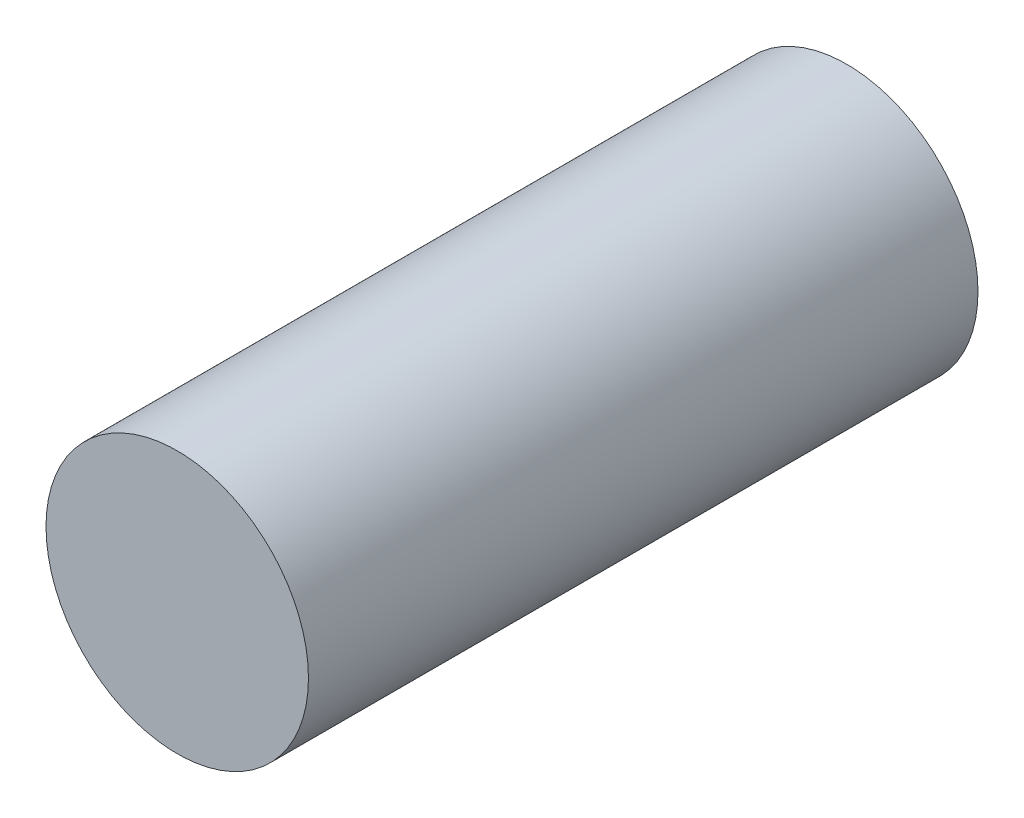
from build123d import *

# Parameters (mm, degrees)
SKETCH1_R           = 1.2446
BOSS_EXTRUDE1_DEPTH = 6.35


with BuildPart() as part:
    # Sketch1 → Boss-Extrude1 (new body)
    with BuildSketch(Plane.XY):
        Circle(SKETCH1_R)
    extrude(amount=BOSS_EXTRUDE1_DEPTH)


solid = part.part
